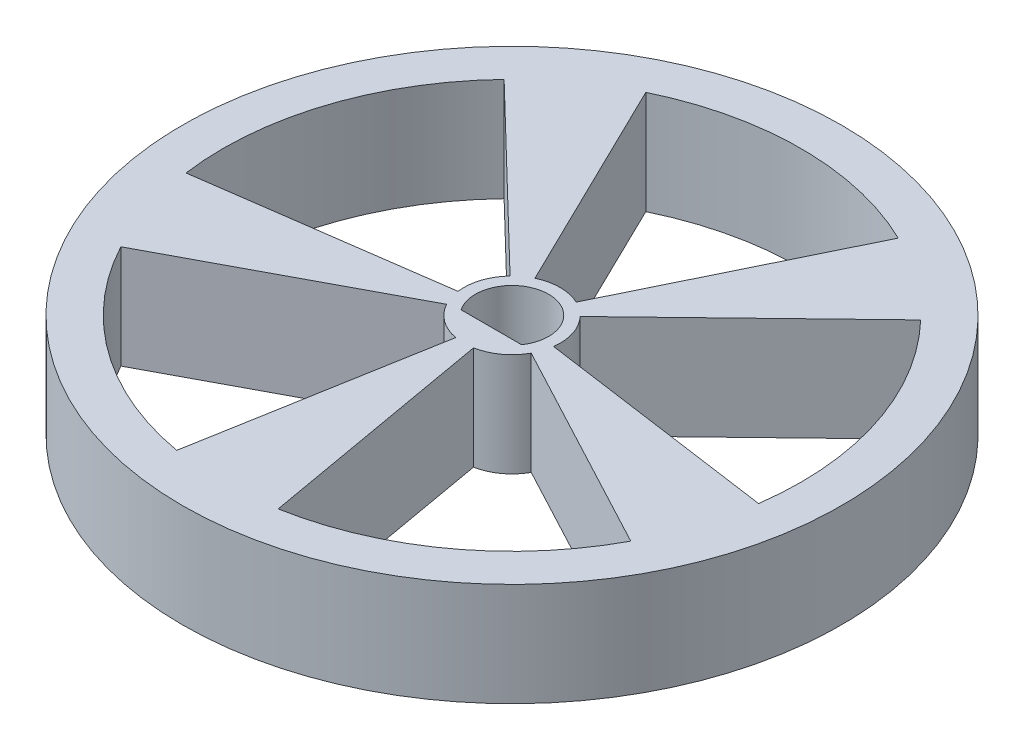
from build123d import *

# Parameters (mm, degrees)
SKETCH1_R           = 12.153059969
BOSS_EXTRUDE1_DEPTH = 3.81
SKETCH1_8_R         = 1.350728719
BOSS_EXTRUDE3_DEPTH = 0.254


with BuildPart() as part:
    # Sketch1 → Boss-Extrude1 (new body)
    with BuildSketch(Plane(origin=(0, 0, 0), x_dir=(1, 0, 0), z_dir=(0, 1, 0))):
        Circle(SKETCH1_R)
        with BuildLine():
            Line((1.11526861, -0.762), (-1.11526861, -0.762))
            ThreePointArc((-1.11526861, -0.762), (0, 1.350728719), (1.11526861, -0.762))
        make_face(mode=Mode.SUBTRACT)
        with BuildLine():
            Line((-9.401654798, -5.02134393), (-1.560500416, -0.85212819))
            ThreePointArc((-1.560500416, -0.85212819), (-1.045082179, -1.438432216), (-0.32820092, -1.747446181))
            Line((-0.32820092, -1.747446181), (-1.870310758, -10.493185668))
            ThreePointArc((-1.870310758, -10.493185668), (-6.264947316, -8.622960218), (-9.401654798, -5.02134393))
        make_face(mode=Mode.SUBTRACT)
        with BuildLine():
            Line((-1.763339739, -0.227852943), (-10.557570415, -1.463801463))
            ThreePointArc((-10.557570415, -1.463801463), (-10.136897695, 3.29367772), (-7.680852973, 7.38982445))
            Line((-7.680852973, 7.38982445), (-1.292643216, 1.220801997))
            ThreePointArc((-1.292643216, 1.220801997), (-1.690978486, 0.549432216), (-1.763339739, -0.227852943))
        make_face(mode=Mode.SUBTRACT)
        with BuildLine():
            ThreePointArc((9.401654798, -5.02134393), (6.264947316, -8.622960218), (1.870310758, -10.493185668))
            Line((1.870310758, -10.493185668), (0.32820092, -1.747446181))
            ThreePointArc((0.32820092, -1.747446181), (1.045082179, -1.438432216), (1.560500416, -0.85212819))
            Line((1.560500416, -0.85212819), (9.401654798, -5.02134393))
        make_face(mode=Mode.SUBTRACT)
        with BuildLine():
            Line((10.557570415, -1.463801463), (1.763339739, -0.227852943))
            ThreePointArc((1.763339739, -0.227852943), (1.690978486, 0.549432216), (1.292643216, 1.220801997))
            Line((1.292643216, 1.220801997), (7.680852973, 7.38982445))
            ThreePointArc((7.680852973, 7.38982445), (10.136897695, 3.29367772), (10.557570415, -1.463801463))
        make_face(mode=Mode.SUBTRACT)
        with BuildLine():
            ThreePointArc((-4.654626598, 9.588506611), (0, 10.658564997), (4.654626598, 9.588506611))
            Line((4.654626598, 9.588506611), (0.761602973, 1.606625318))
            ThreePointArc((0.761602973, 1.606625318), (0, 1.778), (-0.761602973, 1.606625318))
            Line((-0.761602973, 1.606625318), (-4.654626598, 9.588506611))
        make_face(mode=Mode.SUBTRACT)
    extrude(amount=BOSS_EXTRUDE1_DEPTH)

    # Sketch1<8> → Boss-Extrude3 (add)
    with BuildSketch(Plane(origin=(0, 0, 0), x_dir=(1, 0, 0), z_dir=(0, 1, 0))):
        Circle(SKETCH1_8_R)
    extrude(amount=BOSS_EXTRUDE3_DEPTH)


solid = part.part
